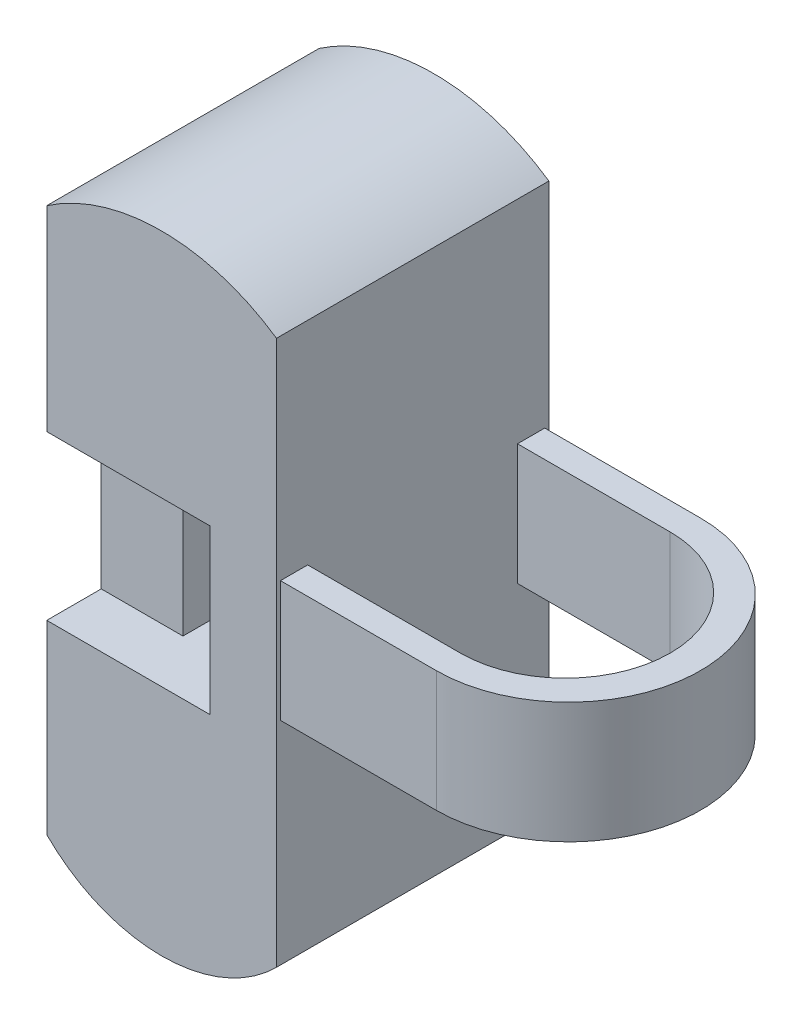
from build123d import *

# Parameters (mm, degrees)
EXTRUDE_1_DEPTH     = 5
EXTRUDE_7_DEPTH     = 2.220844282
CUT_EXTRUDE_5_DEPTH = 4.5
SKETCH_22_W         = 3
SKETCH_22_H         = 6
CUT_EXTRUDE_7_DEPTH = 10
SKETCH_24_W         = 3
SKETCH_24_H         = 6
CUT_EXTRUDE_8_DEPTH = 2
SKETCH_25_W         = 3
SKETCH_25_H         = 6
CUT_EXTRUDE_9_DEPTH = 2


with BuildPart() as part:
    # 草圖1 → 填料-伸長1 (new, symmetric)
    with BuildSketch(Plane.XY):
        with BuildLine():
            Line((0, 0), (0, -20))
            ThreePointArc((0, -20), (4.217076995, -21.746770485), (8.434153991, -20))
            Line((8.434153991, -20), (8.434153991, 0))
            ThreePointArc((8.434153991, 0), (4.217076995, 1.305083655), (0, 0))
        make_face()
    extrude(amount=EXTRUDE_1_DEPTH, both=True)

    # 草圖19 → 填料-伸長7 (add, symmetric)
    with BuildSketch(Plane(origin=(-5.031859453, -10, 0), x_dir=(1, 0, 0), z_dir=(0, 1, 0))):
        with BuildLine():
            Line((8.364623855, 4.848181061), (19.186976182, 4.848181061))
            ThreePointArc((19.186976182, 4.848181061), (24.038353521, -0.003196277), (19.186976182, -4.854573616))
            Line((19.186976182, -4.854573616), (8.364623855, -4.854573616))
            Line((8.364623855, -4.854573616), (8.364623855, 4.848181061))
        make_face()
    extrude(amount=EXTRUDE_7_DEPTH, both=True)

    # 草圖21 → 除料-伸長5 (cut)
    with BuildSketch(Plane(origin=(0, -7.779155718, 0), x_dir=(1, 0, 0), z_dir=(0, 1, 0))):
        with BuildLine():
            Line((8.434153991, 3.848181061), (14.041459842, 3.848181061))
            ThreePointArc((14.041459842, 3.848181061), (17.892837181, -0.003196277), (14.041459842, -3.854573616))
            Line((14.041459842, -3.854573616), (8.434153991, -3.854573616))
            Line((8.434153991, -3.854573616), (8.434153991, 3.848181061))
        make_face()
    extrude(amount=-CUT_EXTRUDE_5_DEPTH, mode=Mode.SUBTRACT)

    # 草圖22 → 除料-伸長7 (cut)
    with BuildSketch(Plane.XY.offset(5)):
        with Locations((4.5, -10.185420111)):
            Rectangle(SKETCH_22_W, SKETCH_22_H)
    extrude(amount=-CUT_EXTRUDE_7_DEPTH, mode=Mode.SUBTRACT)

    # 草圖24 → 除料-伸長8 (cut)
    with BuildSketch(Plane(origin=(0, 0, -5), x_dir=(-1, 0, 0), z_dir=(0, 0, -1))):
        with Locations((-1.5, -10.185420111)):
            Rectangle(SKETCH_24_W, SKETCH_24_H)
    extrude(amount=-CUT_EXTRUDE_8_DEPTH, mode=Mode.SUBTRACT)

    # 草圖25 → 除料-伸長9 (cut)
    with BuildSketch(Plane.XY.offset(5)):
        with Locations((1.5, -10.185420111)):
            Rectangle(SKETCH_25_W, SKETCH_25_H)
    extrude(amount=-CUT_EXTRUDE_9_DEPTH, mode=Mode.SUBTRACT)


solid = part.part
